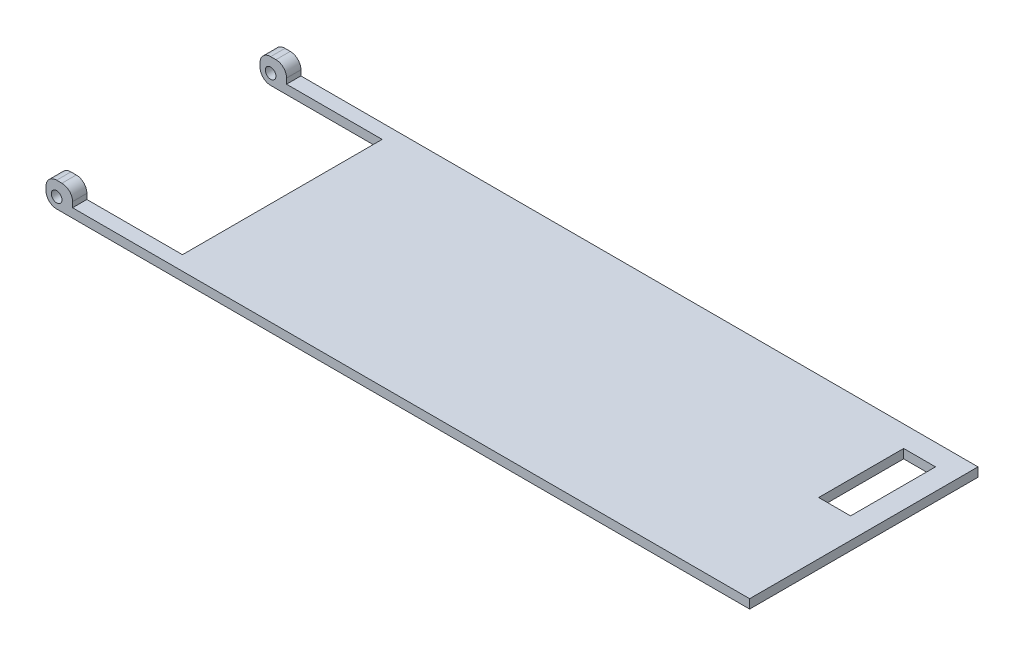
from build123d import *

# Parameters (mm, degrees)
SKETCH1_W            = 132.5
SKETCH1_H            = 43
BOSS_EXTRUDE1_DEPTH  = 1.7
SKETCH2_W            = 23
SKETCH2_H            = 37.6
CUT_EXTRUDE1_DEPTH   = 1.7
SKETCH4_W            = 5
SKETCH4_H            = 2.7
BOSS_EXTRUDE2_DEPTH  = 3
SKETCH5_R            = 1
CUT_EXTRUDE2_DEPTH   = 2.7
FILLET1_R            = 2
FILLET1_OF_MIRROR2_R = 2
SKETCH10_W           = 6
SKETCH10_H           = 16
CUT_EXTRUDE3_DEPTH   = 1.7


with BuildPart() as part:
    # Sketch1 → Boss-Extrude1 (new body)
    with BuildSketch(Plane(origin=(0, 0, 0), x_dir=(1, 0, 0), z_dir=(0, 1, 0))):
        Rectangle(SKETCH1_W, SKETCH1_H)
    extrude(amount=BOSS_EXTRUDE1_DEPTH)

    # Sketch2 → Cut-Extrude1 (cut)
    with BuildSketch(Plane(origin=(0, 1.7, 0), x_dir=(1, 0, 0), z_dir=(0, 1, 0))):
        with Locations((-54.75, 0)):
            Rectangle(SKETCH2_W, SKETCH2_H)
    extrude(amount=-CUT_EXTRUDE1_DEPTH, mode=Mode.SUBTRACT)

    # Sketch4 → Boss-Extrude2 (add)
    with BuildSketch(Plane(origin=(0, 1.7, 0), x_dir=(1, 0, 0), z_dir=(0, 1, 0))):
        with Locations((-63.75, -20.15)):
            Rectangle(SKETCH4_W, SKETCH4_H)
    boss_extrude2 = extrude(amount=BOSS_EXTRUDE2_DEPTH)

    # Sketch5 → Cut-Extrude2 (cut)
    with BuildSketch(Plane.XY.offset(21.5)):
        with Locations((-64.25, 2)):
            Circle(SKETCH5_R)
    cut_extrude2 = extrude(amount=-CUT_EXTRUDE2_DEPTH, mode=Mode.SUBTRACT)

    # Fillet1
    fillet1_edges = [part.edges().sort_by_distance(p)[0] for p in [
        (-66.25, 0, 20.15),
        (-66.25, 4.7, 20.15),
        (-61.25, 4.7, 20.15),
    ]]
    fillet(fillet1_edges, radius=FILLET1_R)

    # Mirror2: Boss-Extrude2, Cut-Extrude2 across plane
    add(boss_extrude2.mirror(Plane.XY))
    add(cut_extrude2.mirror(Plane.XY), mode=Mode.SUBTRACT)

    # Fillet1 of Mirror2
    fillet1_of_mirror2_edges = [part.edges().sort_by_distance(p)[0] for p in [
        (-66.25, 0, -20.15),
        (-66.25, 4.7, -20.15),
        (-61.25, 4.7, -20.15),
    ]]
    fillet(fillet1_of_mirror2_edges, radius=FILLET1_OF_MIRROR2_R)

    # Sketch10 → Cut-Extrude3 (cut)
    with BuildSketch(Plane(origin=(0, 1.7, 0), x_dir=(1, 0, 0), z_dir=(0, 1, 0))):
        with Locations((59.25, 9.5)):
            Rectangle(SKETCH10_W, SKETCH10_H)
    extrude(amount=-CUT_EXTRUDE3_DEPTH, mode=Mode.SUBTRACT)


solid = part.part
